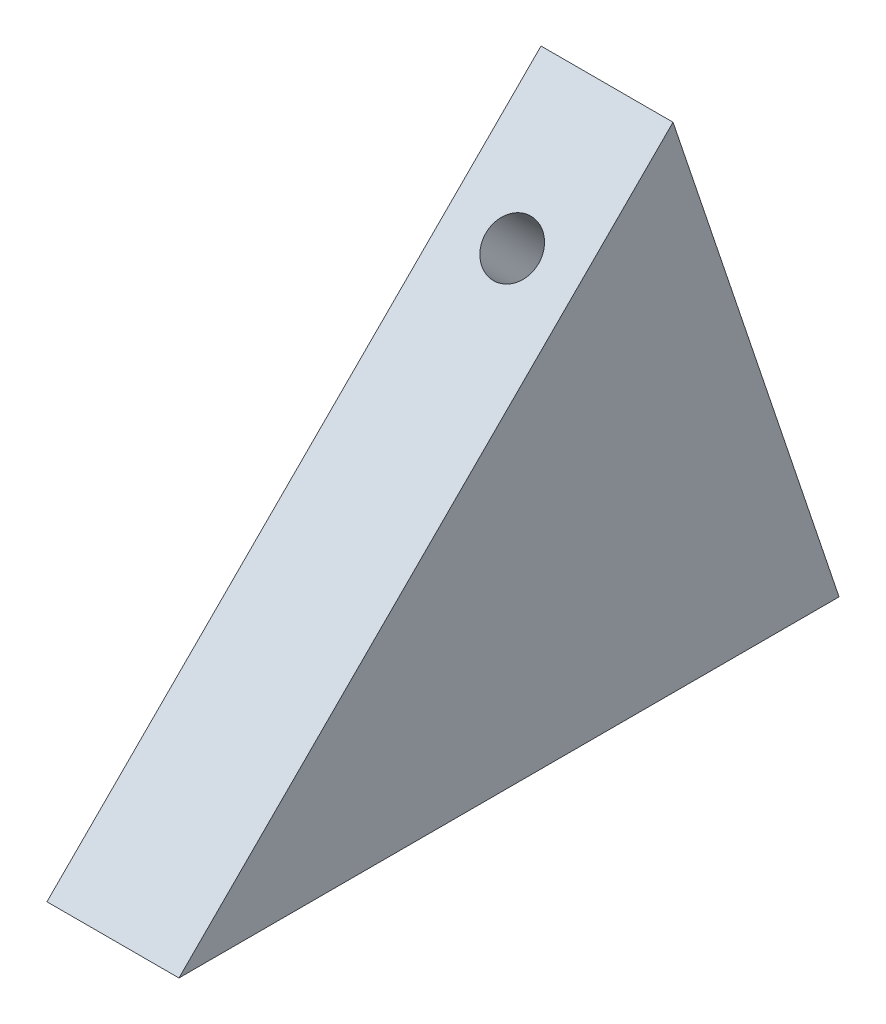
from build123d import *

# Parameters (mm, degrees)
SALIENTE_EXTRUIR1_DEPTH = 10
CROQUIS2_R              = 2
CORTAR_EXTRUIR1_DEPTH   = 10
CROQUIS3_R              = 2
CORTAR_EXTRUIR2_DEPTH   = 10


with BuildPart() as part:
    # Croquis1 → Saliente-Extruir1 (new body)
    with BuildSketch(Plane(origin=(0, 0, 0), x_dir=(0, 0, -1), z_dir=(1, 0, 0))):
        Polygon((0, 0), (37.42423058, 37.42423058), (50, 0), align=None)
    extrude(amount=SALIENTE_EXTRUIR1_DEPTH)

    # Croquis2 → Cortar-Extruir1 (cut)
    with BuildSketch(Plane.XZ):
        with Locations(Location((5, -34.477712546, 0), (0, 0, 270))):
            Circle(CROQUIS2_R)
    extrude(amount=-CORTAR_EXTRUIR1_DEPTH, mode=Mode.SUBTRACT)

    # Croquis3 → Cortar-Extruir2 (cut)
    with BuildSketch(Plane(origin=(0, 0, 0), x_dir=(1, 0, 0), z_dir=(0, 0.7071067811865512, 0.7071067811865439))):
        with Locations(Location((5, 42.766502378, 0), (0, 0, 270))):
            Circle(CROQUIS3_R)
    extrude(amount=-CORTAR_EXTRUIR2_DEPTH, mode=Mode.SUBTRACT)


solid = part.part
